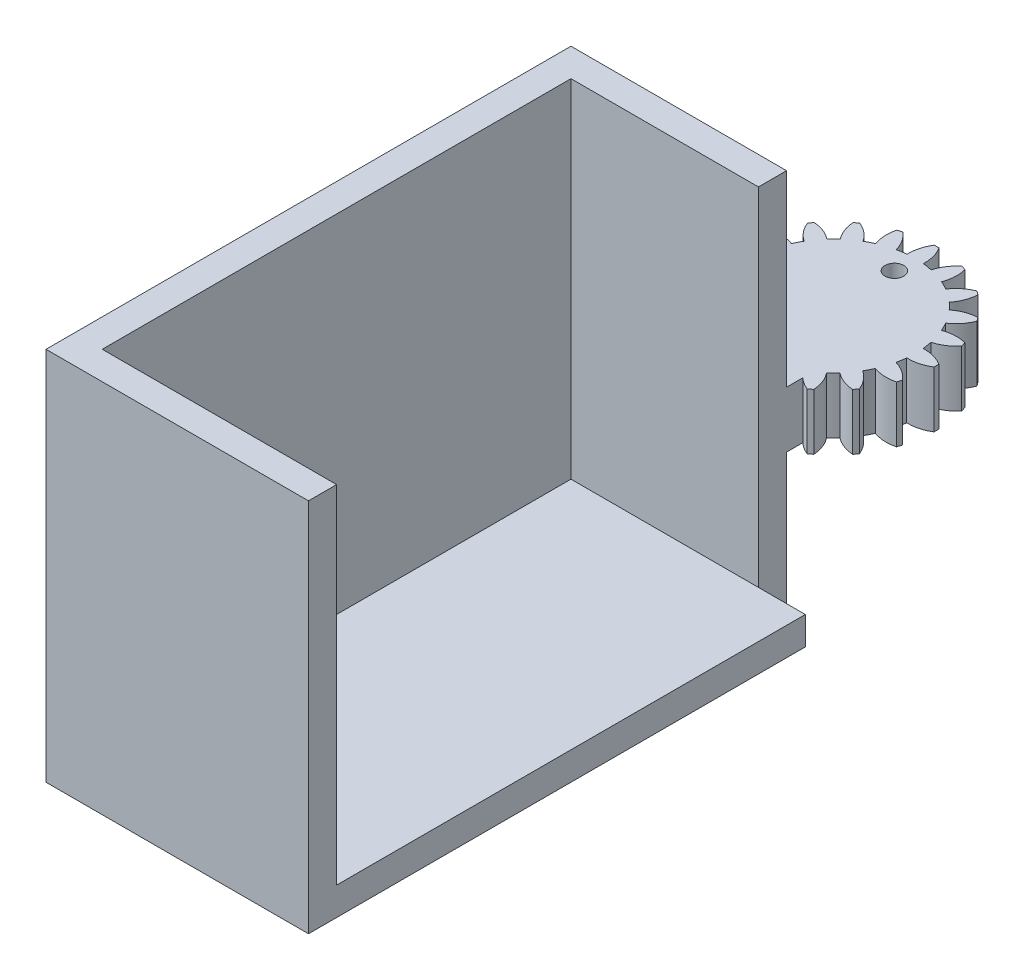
from build123d import *

# Parameters (mm, degrees)
EXTRUDE_1_DEPTH     = 6
EXTRUDE_2_DEPTH     = 20
SKETCH_3_W          = 25
SKETCH_3_H          = 50
EXTRUDE_3_DEPTH     = 3
EXTRUDE_4_DEPTH     = 6
SKETCH_5_R          = 1
CUT_EXTRUDE_1_DEPTH = 74.184697854


with BuildPart() as part:
    # 草图1 → 凸台-拉伸1 (new body)
    with BuildSketch(Plane(origin=(0, 0, 0), x_dir=(1, 0, 0), z_dir=(0, 1, 0))):
        with BuildLine():
            Line((5, 0), (5, -13))
            Line((5, -13), (-15, -13))
            Line((-15, -13), (-15, -63))
            Line((-15, -63), (10, -63))
            Line((10, -63), (10, -66))
            Line((10, -66), (-18, -66))
            Line((-18, -66), (-18, -10))
            Line((-18, -10), (-5, -10))
            Line((-5, -10), (-5, 0))
            ThreePointArc((-5, 0), (0, 5), (5, 0))
        make_face()
    extrude(amount=-EXTRUDE_1_DEPTH)

    # 草图2 → 凸台-拉伸2 (add, symmetric)
    with BuildSketch(Plane(origin=(0, 0, 0), x_dir=(1, 0, 0), z_dir=(0, 1, 0))):
        Polygon((-15, -13), (5, -13), (5, -10), (-18, -10), (-18, -66), (10, -66), (10, -63), (-15, -63), align=None)
    extrude(amount=EXTRUDE_2_DEPTH, both=True)

    # 草图3 → 凸台-拉伸3 (add)
    with BuildSketch(Plane.XZ.offset(20)):
        with Locations((-2.5, 38)):
            Rectangle(SKETCH_3_W, SKETCH_3_H)
    extrude(amount=-EXTRUDE_3_DEPTH)

    # 草图4 → 凸台-拉伸4 (add)
    with BuildSketch(Plane.XZ.offset(6)):
        with BuildLine():
            ThreePointArc((0.860680542, 8.706562468), (0.72579344, 9.898750182), (0.24342364, 10.997306258))
            ThreePointArc((0.24342364, 10.997306258), (-0.01511058, 10.999989621), (-0.273636452, 10.996595977))
            ThreePointArc((-0.273636452, 10.996595977), (-0.752986286, 9.896718796), (-0.884597491, 8.704164996))
            ThreePointArc((-0.884597491, 8.704164996), (-1.380514283, 8.639397046), (-1.871919927, 8.546397884))
            ThreePointArc((-1.871919927, 8.546397884), (-2.368611449, 9.638553371), (-3.166844887, 10.53428182))
            ThreePointArc((-3.166844887, 10.53428182), (-3.413554747, 10.456942383), (-3.658378768, 10.373825947))
            ThreePointArc((-3.658378768, 10.373825947), (-3.77438681, 9.179653342), (-3.531037114, 8.00479718))
            ThreePointArc((-3.531037114, 8.00479718), (-3.982667613, 7.789952483), (-4.421283831, 7.549652329))
            ThreePointArc((-4.421283831, 7.549652329), (-5.231160146, 8.434867801), (-6.267120572, 9.040088481))
            ThreePointArc((-6.267120572, 9.040088481), (-6.477856391, 8.890296766), (-6.685013481, 8.735593555))
            ThreePointArc((-6.685013481, 8.735593555), (-6.426324056, 7.564019461), (-5.831834222, 6.521864044))
            ThreePointArc((-5.831834222, 6.521864044), (-6.194969688, 6.177973095), (-6.537861669, 5.813894202))
            ThreePointArc((-6.537861669, 5.813894202), (-7.58164644, 6.405518601), (-8.753926829, 6.660988295))
            ThreePointArc((-8.753926829, 6.660988295), (-8.908060318, 6.453406959), (-9.057272497, 6.242260401))
            ThreePointArc((-9.057272497, 6.242260401), (-8.449207929, 5.207966653), (-7.561770763, 4.400525414))
            ThreePointArc((-7.561770763, 4.400525414), (-7.800864967, 3.961250657), (-8.014468055, 3.509031603))
            ThreePointArc((-8.014468055, 3.509031603), (-9.189988356, 3.74915261), (-10.383837737, 3.629864165))
            ThreePointArc((-10.383837737, 3.629864165), (-10.466281235, 3.384812715), (-10.542942575, 3.137891306))
            ThreePointArc((-10.542942575, 3.137891306), (-9.64502446, 2.342121783), (-8.551508496, 1.848432697))
            ThreePointArc((-8.551508496, 1.848432697), (-8.643157232, 1.356773404), (-8.706562468, 0.860680542))
            ThreePointArc((-8.706562468, 0.860680542), (-9.898750182, 0.72579344), (-10.997306258, 0.24342364))
            ThreePointArc((-10.997306258, 0.24342364), (-10.999989621, -0.01511058), (-10.996595977, -0.273636452))
            ThreePointArc((-10.996595977, -0.273636452), (-9.896718796, -0.752986286), (-8.704164996, -0.884597491))
            ThreePointArc((-8.704164996, -0.884597491), (-8.639397046, -1.380514283), (-8.546397884, -1.871919927))
            ThreePointArc((-8.546397884, -1.871919927), (-9.638553371, -2.368611449), (-10.53428182, -3.166844887))
            ThreePointArc((-10.53428182, -3.166844887), (-10.456942383, -3.413554747), (-10.373825947, -3.658378768))
            ThreePointArc((-10.373825947, -3.658378768), (-9.179653342, -3.77438681), (-8.00479718, -3.531037114))
            ThreePointArc((-8.00479718, -3.531037114), (-7.789952483, -3.982667613), (-7.549652329, -4.421283831))
            ThreePointArc((-7.549652329, -4.421283831), (-8.434867801, -5.231160146), (-9.040088481, -6.267120572))
            ThreePointArc((-9.040088481, -6.267120572), (-8.890296766, -6.477856391), (-8.735593555, -6.685013481))
            ThreePointArc((-8.735593555, -6.685013481), (-7.564019461, -6.426324056), (-6.521864044, -5.831834222))
            ThreePointArc((-6.521864044, -5.831834222), (-6.177973095, -6.194969688), (-5.813894202, -6.537861669))
            ThreePointArc((-5.813894202, -6.537861669), (-6.405518601, -7.58164644), (-6.660988295, -8.753926829))
            ThreePointArc((-6.660988295, -8.753926829), (-6.453406959, -8.908060318), (-6.242260401, -9.057272497))
            ThreePointArc((-6.242260401, -9.057272497), (-5.207966653, -8.449207929), (-4.400525414, -7.561770763))
            ThreePointArc((-4.400525414, -7.561770763), (-3.961250657, -7.800864967), (-3.509031603, -8.014468055))
            ThreePointArc((-3.509031603, -8.014468055), (-3.74915261, -9.189988356), (-3.629864165, -10.383837737))
            ThreePointArc((-3.629864165, -10.383837737), (-3.384812715, -10.466281235), (-3.137891306, -10.542942575))
            ThreePointArc((-3.137891306, -10.542942575), (-2.342121783, -9.64502446), (-1.848432697, -8.551508496))
            ThreePointArc((-1.848432697, -8.551508496), (-1.356773404, -8.643157232), (-0.860680542, -8.706562468))
            ThreePointArc((-0.860680542, -8.706562468), (-0.72579344, -9.898750182), (-0.24342364, -10.997306258))
            ThreePointArc((-0.24342364, -10.997306258), (0.01511058, -10.999989621), (0.273636452, -10.996595977))
            ThreePointArc((0.273636452, -10.996595977), (0.752986286, -9.896718796), (0.884597491, -8.704164996))
            ThreePointArc((0.884597491, -8.704164996), (1.380514283, -8.639397046), (1.871919927, -8.546397884))
            ThreePointArc((1.871919927, -8.546397884), (2.368611449, -9.638553371), (3.166844887, -10.53428182))
            ThreePointArc((3.166844887, -10.53428182), (3.413554747, -10.456942383), (3.658378768, -10.373825947))
            ThreePointArc((3.658378768, -10.373825947), (3.77438681, -9.179653342), (3.531037114, -8.00479718))
            ThreePointArc((3.531037114, -8.00479718), (3.982667613, -7.789952483), (4.421283831, -7.549652329))
            ThreePointArc((4.421283831, -7.549652329), (5.231160146, -8.434867801), (6.267120572, -9.040088481))
            ThreePointArc((6.267120572, -9.040088481), (6.477856391, -8.890296766), (6.685013481, -8.735593555))
            ThreePointArc((6.685013481, -8.735593555), (6.426324056, -7.564019461), (5.831834222, -6.521864044))
            ThreePointArc((5.831834222, -6.521864044), (6.194969688, -6.177973095), (6.537861669, -5.813894202))
            ThreePointArc((6.537861669, -5.813894202), (7.58164644, -6.405518601), (8.753926829, -6.660988295))
            ThreePointArc((8.753926829, -6.660988295), (8.908060318, -6.453406959), (9.057272497, -6.242260401))
            ThreePointArc((9.057272497, -6.242260401), (8.449207929, -5.207966653), (7.561770763, -4.400525414))
            ThreePointArc((7.561770763, -4.400525414), (7.800864967, -3.961250657), (8.014468055, -3.509031603))
            ThreePointArc((8.014468055, -3.509031603), (9.189988356, -3.74915261), (10.383837737, -3.629864165))
            ThreePointArc((10.383837737, -3.629864165), (10.466281235, -3.384812715), (10.542942575, -3.137891306))
            ThreePointArc((10.542942575, -3.137891306), (9.64502446, -2.342121783), (8.551508496, -1.848432697))
            ThreePointArc((8.551508496, -1.848432697), (8.643157232, -1.356773404), (8.706562468, -0.860680542))
            ThreePointArc((8.706562468, -0.860680542), (9.898750182, -0.72579344), (10.997306258, -0.24342364))
            ThreePointArc((10.997306258, -0.24342364), (10.999989621, 0.01511058), (10.996595977, 0.273636452))
            ThreePointArc((10.996595977, 0.273636452), (9.896718796, 0.752986286), (8.704164996, 0.884597491))
            ThreePointArc((8.704164996, 0.884597491), (8.639397046, 1.380514283), (8.546397884, 1.871919927))
            ThreePointArc((8.546397884, 1.871919927), (9.638553371, 2.368611449), (10.53428182, 3.166844887))
            ThreePointArc((10.53428182, 3.166844887), (10.456942383, 3.413554747), (10.373825947, 3.658378768))
            ThreePointArc((10.373825947, 3.658378768), (9.179653342, 3.77438681), (8.00479718, 3.531037114))
            ThreePointArc((8.00479718, 3.531037114), (7.789952483, 3.982667613), (7.549652329, 4.421283831))
            ThreePointArc((7.549652329, 4.421283831), (8.434867801, 5.231160146), (9.040088481, 6.267120572))
            ThreePointArc((9.040088481, 6.267120572), (8.890296766, 6.477856391), (8.735593555, 6.685013481))
            ThreePointArc((8.735593555, 6.685013481), (7.564019461, 6.426324056), (6.521864044, 5.831834222))
            ThreePointArc((6.521864044, 5.831834222), (6.177973095, 6.194969688), (5.813894202, 6.537861669))
            ThreePointArc((5.813894202, 6.537861669), (6.405518601, 7.58164644), (6.660988295, 8.753926829))
            ThreePointArc((6.660988295, 8.753926829), (6.453406959, 8.908060318), (6.242260401, 9.057272497))
            ThreePointArc((6.242260401, 9.057272497), (5.207966653, 8.449207929), (4.400525414, 7.561770763))
            ThreePointArc((4.400525414, 7.561770763), (3.961250657, 7.800864967), (3.509031603, 8.014468055))
            ThreePointArc((3.509031603, 8.014468055), (3.74915261, 9.189988356), (3.629864165, 10.383837737))
            ThreePointArc((3.629864165, 10.383837737), (3.384812715, 10.466281235), (3.137891306, 10.542942575))
            ThreePointArc((3.137891306, 10.542942575), (2.342121783, 9.64502446), (1.848432697, 8.551508496))
            ThreePointArc((1.848432697, 8.551508496), (1.356773404, 8.643157232), (0.860680542, 8.706562468))
        make_face()
    extrude(amount=-EXTRUDE_4_DEPTH)

    # 草图5 → 切除-拉伸1 (cut, through all)
    with BuildSketch(Plane.XZ.offset(6)):
        with Locations(Location((0, 6.5, 0), (0, 0, 270))):
            Circle(SKETCH_5_R)
        with Locations(Location((0, -6.5, 0), (0, 0, 270))):
            Circle(SKETCH_5_R)
    extrude(amount=-CUT_EXTRUDE_1_DEPTH, mode=Mode.SUBTRACT)


solid = part.part
